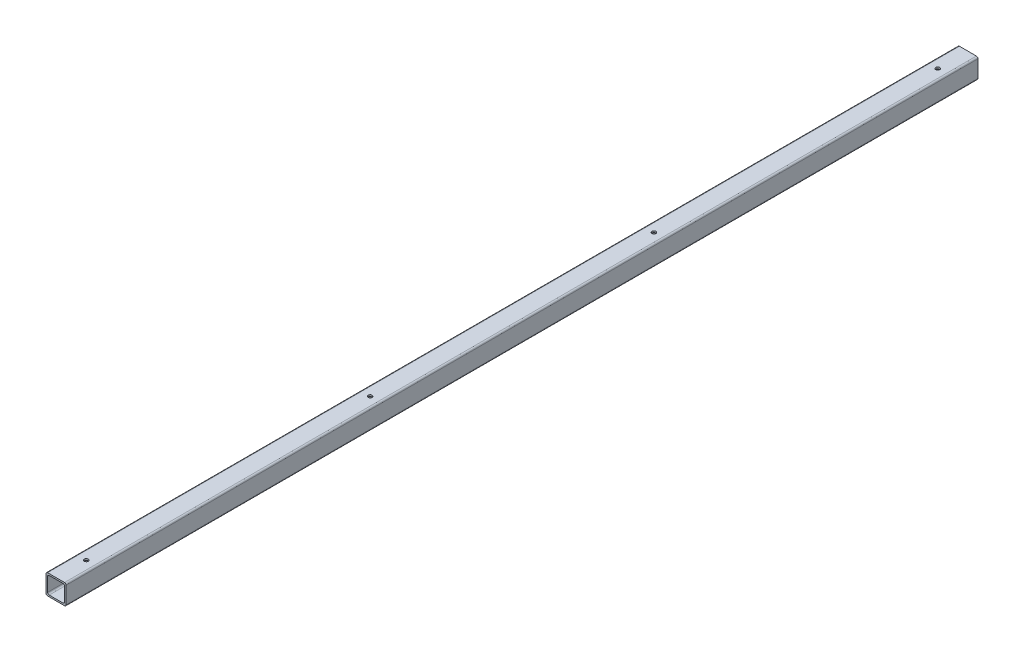
from build123d import *

# Parameters (mm, degrees)
CROQUIS1_W              = 25.4
CROQUIS1_H              = 25.4
CROQUIS1_W_2            = 21.4
CROQUIS1_H_2            = 21.4
SALIENTE_EXTRUIR1_DEPTH = 1150
REDONDEO1_R             = 2
CROQUIS2_R              = 2.5
CORTAR_EXTRUIR1_DEPTH   = 10
MATRIZL1_COUNT          = 4
MATRIZL1_PITCH          = 357.9333
CROQUIS3_R              = 6
CORTAR_EXTRUIR2_DEPTH   = 10
MATRIZL2_COUNT          = 4
MATRIZL2_PITCH          = 357.9333


with BuildPart() as part:
    # Croquis1 → Saliente-Extruir1 (new body)
    with BuildSketch(Plane.XY):
        Rectangle(CROQUIS1_W, CROQUIS1_H)
        Rectangle(CROQUIS1_W_2, CROQUIS1_H_2, mode=Mode.SUBTRACT)
    extrude(amount=SALIENTE_EXTRUIR1_DEPTH)

    # Redondeo1
    redondeo1_edges = [part.edges().sort_by_distance(p)[0] for p in [
        (-10.7, 10.7, 575),
        (-10.7, -10.7, 575),
        (10.7, -10.7, 575),
        (10.7, 10.7, 575),
        (-12.7, 12.7, 575),
        (12.7, 12.7, 575),
        (12.7, -12.7, 575),
        (-12.7, -12.7, 575),
    ]]
    fillet(redondeo1_edges, radius=REDONDEO1_R)

    # Croquis2 → Cortar-Extruir1 (cut)
    with BuildSketch(Plane(origin=(0, 12.7, 0), x_dir=(1, 0, 0), z_dir=(0, 1, 0))):
        with Locations(Location((0, -1111.9, 0), (0, 0, 180))):
            Circle(CROQUIS2_R)
    cortar_extruir1 = extrude(amount=-CORTAR_EXTRUIR1_DEPTH, mode=Mode.SUBTRACT)

    # MatrizL1: Cortar-Extruir1 ×4
    with Locations(*[(0, 0, -i * MATRIZL1_PITCH) for i in range(1, MATRIZL1_COUNT)]):
        add(cortar_extruir1, mode=Mode.SUBTRACT)

    # Croquis3 → Cortar-Extruir2 (cut)
    with BuildSketch(Plane.XZ.offset(12.7)):
        with Locations((0, 1111.9)):
            Circle(CROQUIS3_R)
    cortar_extruir2 = extrude(amount=-CORTAR_EXTRUIR2_DEPTH, mode=Mode.SUBTRACT)

    # MatrizL2: Cortar-Extruir2 ×4
    with Locations(*[(0, 0, -i * MATRIZL2_PITCH) for i in range(1, MATRIZL2_COUNT)]):
        add(cortar_extruir2, mode=Mode.SUBTRACT)


solid = part.part
